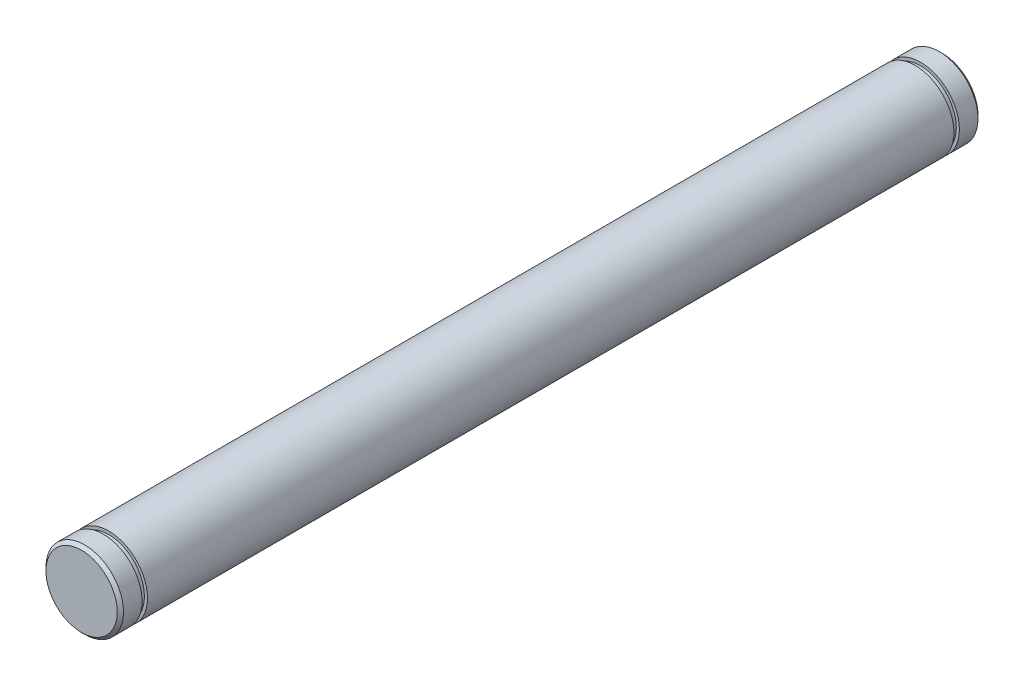
from build123d import *

# Parameters (mm, degrees)
SKETCH_1_R      = 2.5
EXTRUDE_1_DEPTH = 27.75
SKETCH_2_W      = 0.35
SKETCH_2_H      = 0.2
CHAMFER_1_SIZE  = 0.2


with BuildPart() as part:
    # 草图1 → 凸台-拉伸1 (new, symmetric)
    with BuildSketch(Plane.XY):
        Circle(SKETCH_1_R)
    extrude(amount=EXTRUDE_1_DEPTH, both=True)

    # 草图2 → 切除-旋转1 (revolve, cut)
    with BuildSketch(Plane(origin=(0, 0, 0), x_dir=(0, 0, -1), z_dir=(1, 0, 0)), mode=Mode.PRIVATE) as cut_revolve_1_sk:
        with Locations((-26.175, 2.4)):
            Rectangle(SKETCH_2_W, SKETCH_2_H)
        with Locations((26.175, 2.4)):
            Rectangle(SKETCH_2_W, SKETCH_2_H)
    revolve(cut_revolve_1_sk.sketch.rotate(Axis((0, 0, 27.75), (0, 0, -1)), 90), axis=Axis((0, 0, 27.75), (0, 0, -1)), mode=Mode.SUBTRACT)

    # 倒角1
    chamfer_1_edges = [part.edges().sort_by_distance(p)[0] for p in [
        (-2.5, 0, -27.75),
        (-2.5, 0, 27.75),
    ]]
    chamfer(chamfer_1_edges, length=CHAMFER_1_SIZE)


solid = part.part
